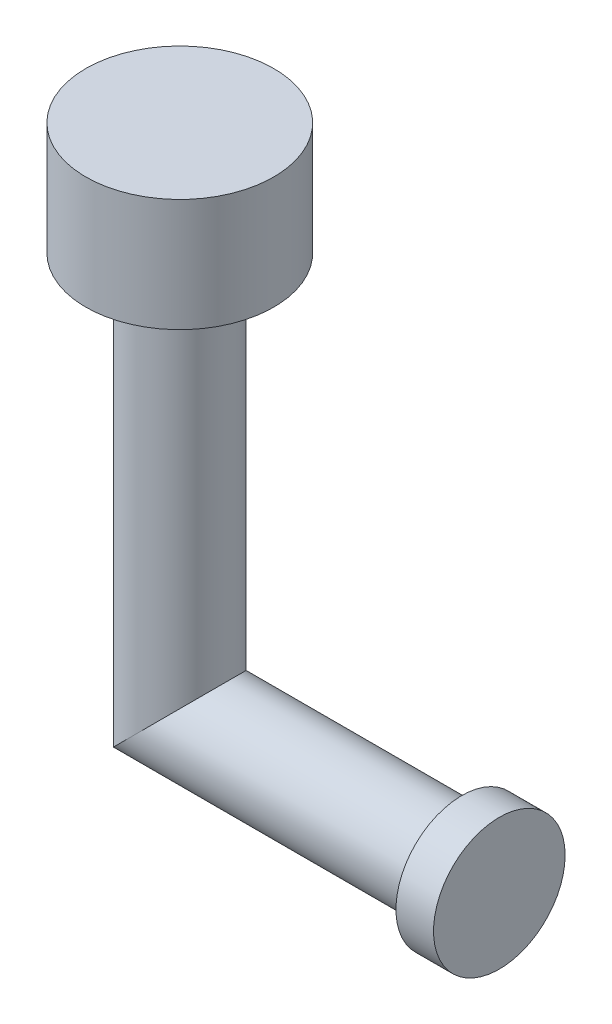
from build123d import *

# Parameters (mm, degrees)
SKETCH2_R           = 2.5
SKETCH3_R           = 3.5
BOSS_EXTRUDE1_DEPTH = 2
SKETCH4_R           = 5
BOSS_EXTRUDE2_DEPTH = 6


with BuildPart() as part:
    # Sweep1: sweep along a path in Sketch1
    with BuildLine(Plane.XY) as sweep1_path:
        Line((0, 21), (0, 0))
        Line((0, 0), (15, 0))
    # Sketch2 → Sweep1 (sweep)
    with BuildSketch(Plane(origin=(15, 0, 0), x_dir=(0, 0, -1), z_dir=(1, 0, 0))):
        Circle(SKETCH2_R)
    sweep(path=sweep1_path.line, transition=Transition.RIGHT)

    # Sketch3 → Boss-Extrude1 (add)
    with BuildSketch(Plane(origin=(15, 0, 0), x_dir=(0, 0, -1), z_dir=(1, 0, 0))):
        Circle(SKETCH3_R)
    extrude(amount=BOSS_EXTRUDE1_DEPTH)

    # Sketch4 → Boss-Extrude2 (add)
    with BuildSketch(Plane(origin=(0, 21, 0), x_dir=(1, 0, 0), z_dir=(0, 1, 0))):
        with Locations(Location((0, 0, 0), (0, 0, 180))):
            Circle(SKETCH4_R)
    extrude(amount=BOSS_EXTRUDE2_DEPTH)


solid = part.part
